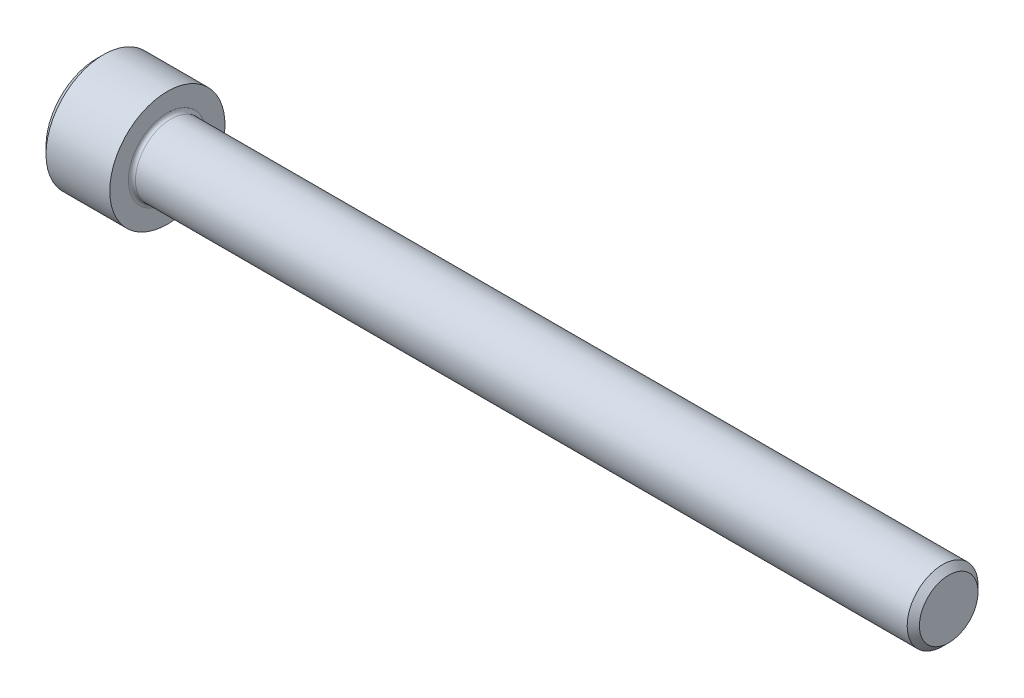
from build123d import *

# Parameters (mm, degrees)
FILLET1_R   = 0.4
HEX_2_DEPTH = 4


with BuildPart() as part:
    # BodySke → Base-Revolve (revolve)
    with BuildSketch(Plane.XY, mode=Mode.PRIVATE) as base_revolve_sk:
        Polygon((0, 0), (0, 5.7), (0.8, 6.5), (8, 6.5), (8, 4), (95.5095, 4), (96.2, 3.3095), (96.2, 0), align=None)
    revolve(base_revolve_sk.sketch.rotate(Axis((-31.75, 0, 0), (1, 0, 0)), 90), axis=Axis((-31.75, 0, 0), (1, 0, 0)))

    # Fillet1
    fillet1_edges = [part.edges().sort_by_distance(p)[0] for p in [
        (8, 0, -4),
    ]]
    fillet(fillet1_edges, radius=FILLET1_R)

    # Sketch2 → Hex-PreBroach (revolve, cut)
    with BuildSketch(Plane.XY, mode=Mode.PRIVATE) as hex_prebroach_sk:
        Polygon((0, 3.0475), (4, 3.0475), (5.759474945, 0), (0, 0), align=None)
    revolve(hex_prebroach_sk.sketch.rotate(Axis((0, 0, 0), (1, 0, 0)), 90), axis=Axis((0, 0, 0), (1, 0, 0)), mode=Mode.SUBTRACT)

    # Sketch3 → Hex 2 (cut)
    with BuildSketch(Plane(origin=(0, 0, 0), x_dir=(0, 0.500000000000001, 0.866025403784438), z_dir=(-1, 0, 0))):
        Polygon((1.759474945, 3.0475), (-1.759474945, 3.0475), (-3.518949891, 0), (-1.759474945, -3.0475), (1.759474945, -3.0475), (3.518949891, 0), align=None)
    extrude(amount=-HEX_2_DEPTH, mode=Mode.SUBTRACT)


solid = part.part
